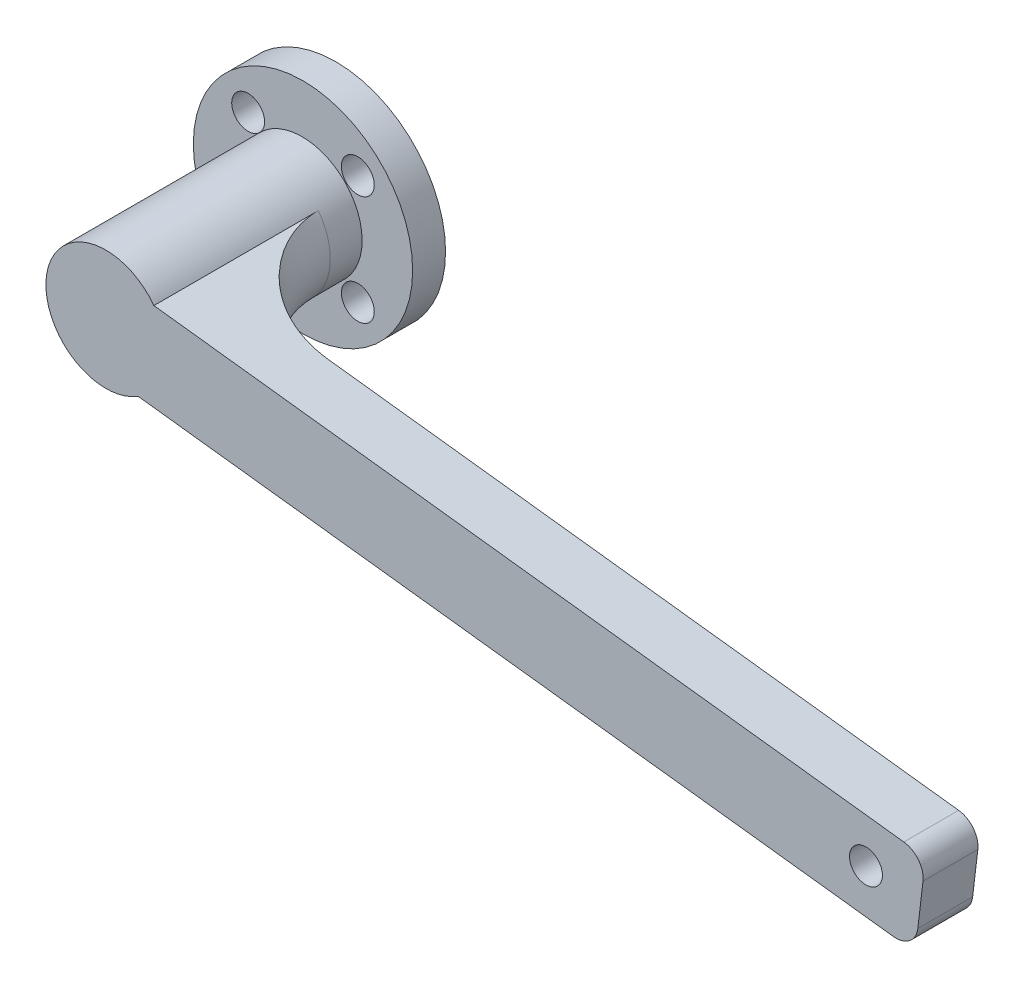
from build123d import *

# Parameters (mm, degrees)
SKETCH_1_R          = 10
EXTRUDE_1_DEPTH     = 3
SKETCH_2_R          = 1.5
CUT_EXTRUDE_1_DEPTH = 15.45683229480096
EXTRUDE_START       = 12.9
SKETCH_3_R          = 5.465897693502911
SKETCH_3_R_2        = 1.5000000000000002
EXTRUDE_2_DEPTH     = 12.9
EXTRUDE_START_2     = -15.9
SKETCH_4_R          = 1.5000000000000002
EXTRUDE_4_DEPTH     = 15.9
EXTRUDE_5_DEPTH     = 5
SKETCH_6_R          = 1.4999999999999973
CUT_EXTRUDE_2_DEPTH = 79.62526207388743
EXTRUDE_START_3     = 5
EXTRUDE_8_DEPTH     = 5
FILLET_1_R          = 10
FILLET_2_R          = 2


with BuildPart() as part:
    # 草图1 → 凸台-拉伸1 (new body)
    with BuildSketch(Plane.XY):
        Circle(SKETCH_1_R)
    extrude(amount=EXTRUDE_1_DEPTH)

    # 草图2 → 切除-拉伸1 (cut, through all)
    with BuildSketch(Plane.XY.offset(3)):
        with BuildLine():
            ThreePointArc((-3.5, 4.999999999999998), (-6.060660171779828, 6.060660171779813), (-4.999999999999981, 3.4999999999999982))
            Line((-5, 3.499999999999999), (-5, 4.999999999999999))
            Line((-5, 4.999999999999998), (-3.5, 4.999999999999998))
        make_face()
        with BuildLine():
            Line((-5, 4.999999999999999), (-5, 3.499999999999999))
            ThreePointArc((-4.999999999999981, 3.4999999999999982), (-3.939339828220172, 3.9393398282201835), (-3.5, 4.999999999999998))
            Line((-3.5, 4.999999999999998), (-5, 4.999999999999998))
        make_face()
        with BuildLine():
            ThreePointArc((3.499999999999999, 5.000000000000001), (3.9393398282201844, 3.939339828220173), (5.000000000000019, 3.5))
            Line((5, 3.500000000000001), (5, 5.000000000000001))
            Line((5, 5.000000000000001), (3.499999999999999, 5.000000000000001))
        make_face()
        with BuildLine():
            Line((5, 5.000000000000001), (5, 3.500000000000001))
            ThreePointArc((5.000000000000019, 3.5), (6.060660171779828, 3.9393398282201852), (6.500000000000001, 5.000000000000001))
            ThreePointArc((6.500000000000001, 5.000000000000001), (5, 6.500000000000002), (3.499999999999999, 5.000000000000001))
            Line((3.499999999999999, 5.000000000000001), (5, 5.000000000000001))
        make_face()
        with BuildLine():
            ThreePointArc((-4.9999999999999805, -3.500000000000001), (-6.060660171779829, -6.060660171779815), (-3.5, -5.000000000000001))
            Line((-3.5, -5.000000000000001), (-5, -5.000000000000001))
            Line((-5, -5.000000000000001), (-5, -3.500000000000001))
        make_face()
        with BuildLine():
            Line((-5, -5.000000000000001), (-3.5, -5.000000000000001))
            ThreePointArc((-3.5, -5.000000000000001), (-3.939339828220172, -3.939339828220186), (-4.9999999999999805, -3.500000000000001))
            Line((-5, -3.500000000000001), (-5, -5.000000000000001))
        make_face()
        with BuildLine():
            ThreePointArc((5.0000000000000195, -3.4999999999999982), (3.9393398282201852, -3.9393398282201706), (3.499999999999999, -4.999999999999999))
            Line((3.499999999999999, -4.999999999999999), (5, -4.999999999999999))
            Line((5, -4.999999999999999), (5, -3.4999999999999982))
        make_face()
        with BuildLine():
            Line((5, -4.999999999999999), (3.499999999999999, -4.999999999999999))
            ThreePointArc((3.499999999999999, -4.999999999999999), (5, -6.5), (6.500000000000001, -4.999999999999999))
            ThreePointArc((6.500000000000001, -4.999999999999999), (6.060660171779829, -3.9393398282201844), (5.0000000000000195, -3.4999999999999982))
            Line((5, -3.4999999999999982), (5, -4.999999999999999))
        make_face()
        Circle(SKETCH_2_R)
    extrude(amount=-CUT_EXTRUDE_1_DEPTH, mode=Mode.SUBTRACT)

    # 草图3 → 凸台-拉伸2 (add)
    with BuildSketch(Plane.XY.offset(3).offset(EXTRUDE_START)):
        with Locations(Location((-0.07436650387235982, 0.07436650387235982, 0), (0, 0, 135))):
            Circle(SKETCH_3_R)
        Circle(SKETCH_3_R_2, mode=Mode.SUBTRACT)
    extrude(amount=-EXTRUDE_2_DEPTH)

    # 草图4 → 凸台-拉伸4 (add)
    with BuildSketch(Plane(origin=(0, 0, 0), x_dir=(-1, 0, 0), z_dir=(0, 0, -1)).offset(EXTRUDE_START_2)):
        Circle(SKETCH_4_R)
    extrude(amount=EXTRUDE_4_DEPTH)

    # 草图5 → 凸台-拉伸5 (add)
    with BuildSketch(Plane.XY.offset(15.9)):
        Polygon((74.67295984530996, -5.059165048643418), (73.72436785298946, -13.002726795876548), (-0.7465235273211024, -4.1096768678718245), (0.2020684649993922, 3.83388487936125), align=None)
    extrude(amount=EXTRUDE_5_DEPTH)

    # 草图6 → 切除-拉伸2 (cut, through all)
    with BuildSketch(Plane.XY.offset(20.900000000000002)):
        with Locations((69.23393775712903, -8.438075927059709)):
            Circle(SKETCH_6_R)
    extrude(amount=-CUT_EXTRUDE_2_DEPTH, mode=Mode.SUBTRACT)

    # 草图7 → 凸台-拉伸8 (add)
    with BuildSketch(Plane.XY.offset(15.9).offset(EXTRUDE_START_3)):
        with BuildLine():
            Line((0.2020684649993922, 3.83388487936125), (4.305897204794468, 3.3438201949921416))
            ThreePointArc((4.305897204794468, 3.3438201949921416), (-5.4500676526118506, 1.0632420042673105), (2.8556757439201084, -4.53983873885273))
            Line((2.8556757439201084, -4.53983873885273), (-0.7465235273211024, -4.1096768678718245))
            Line((-0.7465235273211024, -4.1096768678718245), (0.2020684649993922, 3.83388487936125))
        make_face()
    extrude(amount=-EXTRUDE_8_DEPTH)

    # 圆角1
    fillet_1_edges = [part.edges().sort_by_distance(p)[0] for p in [
        (5.301334644867113, -0.914508996522684, 15.9),
    ]]
    fillet(fillet_1_edges, radius=FILLET_1_R)

    # 圆角2
    fillet_2_edges = [part.edges().sort_by_distance(p)[0] for p in [
        (73.72436785298946, -13.002726795876548, 18.4),
        (74.67295984530996, -5.059165048643418, 18.4),
    ]]
    fillet(fillet_2_edges, radius=FILLET_2_R)


solid = part.part
